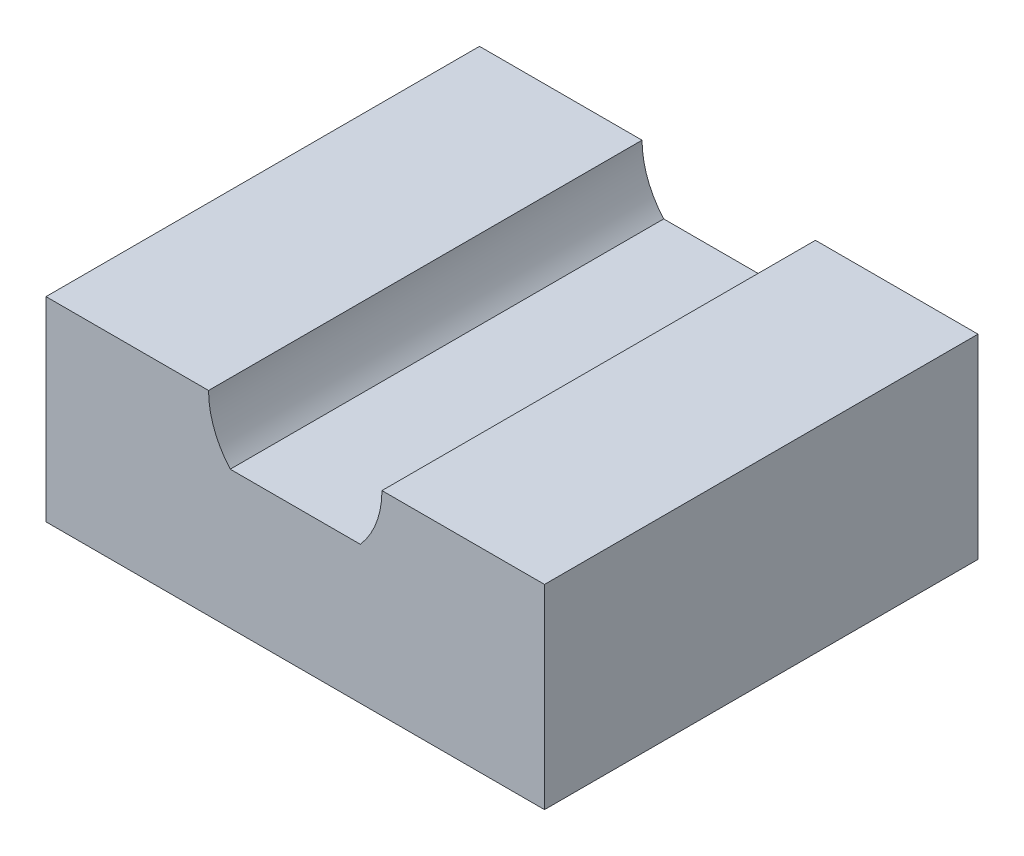
from build123d import *

# Parameters (mm, degrees)
ESTRUSIONE_ESTRUSIONE1_DEPTH = 40


with BuildPart() as part:
    # Schizzo1 → Estrusione-Estrusione1 (new body)
    with BuildSketch(Plane.XY):
        with BuildLine():
            Line((-23, 18), (-23, 0))
            Line((-23, 0), (23, 0))
            Line((23, 0), (23, 18))
            Line((23, 18), (8, 18))
            ThreePointArc((8, 18), (7.483314774, 15.171572875), (6, 12.708497378))
            Line((6, 12.708497378), (-6, 12.708497378))
            ThreePointArc((-6, 12.708497378), (-7.483314774, 15.171572875), (-8, 18))
            Line((-8, 18), (-23, 18))
        make_face()
    extrude(amount=ESTRUSIONE_ESTRUSIONE1_DEPTH)


solid = part.part
